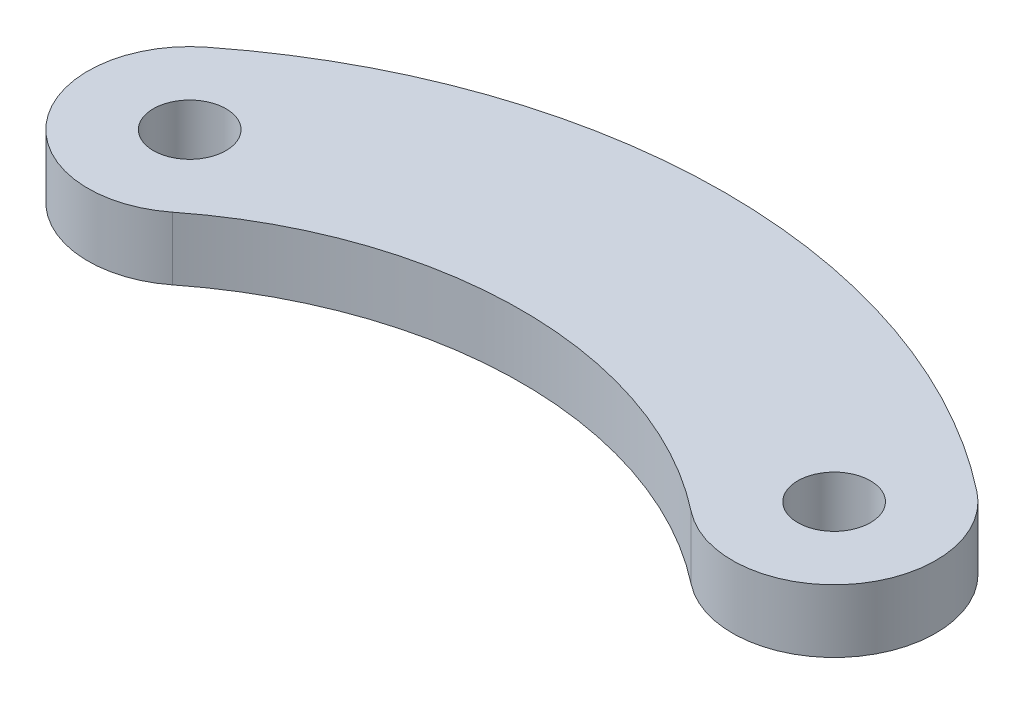
from build123d import *

# Parameters (mm, degrees)
CROQUIS1_R              = 1.5
SALIENTE_EXTRUIR1_DEPTH = 2.6


with BuildPart() as part:
    # Croquis1 → Saliente-Extruir1 (new body)
    with BuildSketch(Plane(origin=(0, 0, 0), x_dir=(1, 0, 0), z_dir=(0, 1, 0))):
        with BuildLine():
            ThreePointArc((10.705140116, 13.624644249), (0, 17.327173913), (-10.705140116, 13.624644249))
            ThreePointArc((-10.705140116, 13.624644249), (-16.602529664, 14.332314029), (-15.894859884, 20.229703577))
            ThreePointArc((-15.894859884, 20.229703577), (0, 25.727173913), (15.894859884, 20.229703577))
            ThreePointArc((15.894859884, 20.229703577), (16.602529664, 14.332314029), (10.705140116, 13.624644249))
        make_face()
        with Locations(Location((13.3, 16.927173913, 0), (0, 0, 270))):
            Circle(CROQUIS1_R, mode=Mode.SUBTRACT)
        with Locations(Location((-13.3, 16.927173913, 0), (0, 0, 270))):
            Circle(CROQUIS1_R, mode=Mode.SUBTRACT)
    extrude(amount=SALIENTE_EXTRUIR1_DEPTH)


solid = part.part
